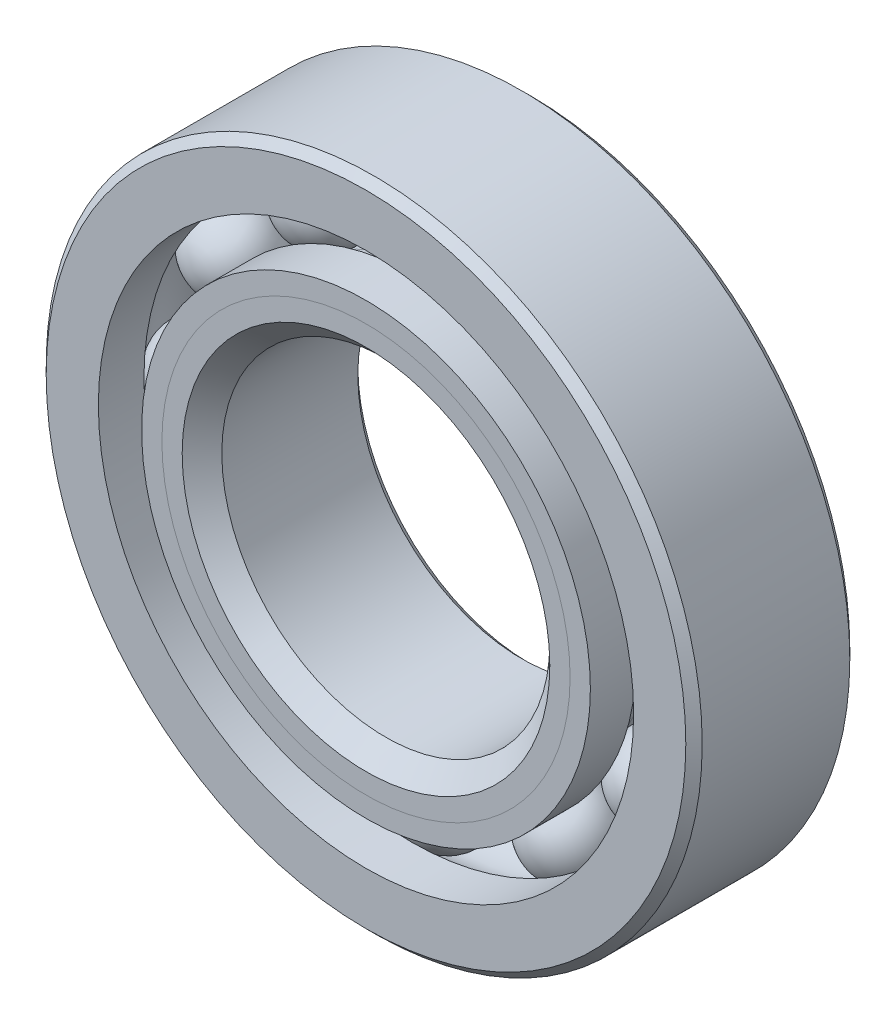
from build123d import *

# Parameters (mm, degrees)
CIRPATTERN1_COUNT = 12


with BuildPart() as part:
    # Sketch1 → Revolve1 (revolve)
    with BuildSketch(Plane(origin=(0, 0, 0), x_dir=(0, 0, -1), z_dir=(1, 0, 0))):
        with BuildLine():
            Line((7.14375, 31.75), (-7.14375, 31.75))
            Line((-7.14375, 31.75), (-7.9375, 30.95625))
            Line((-7.9375, 30.95625), (-7.9375, 25.905906593))
            Line((-7.9375, 25.905906593), (-3.527777778, 25.905906593))
            ThreePointArc((-3.527777778, 25.905906593), (0, 27.914641784), (3.527777778, 25.905906593))
            Line((3.527777778, 25.905906593), (7.9375, 25.905906593))
            Line((7.9375, 25.905906593), (7.9375, 30.95625))
            Line((7.9375, 30.95625), (7.14375, 31.75))
        make_face()
    revolve(axis=Axis((0, 0, 7.9375), (0, 0, -1)))


with BuildPart() as body_2:
    # Sketch2 → Revolve2 (revolve)
    with BuildSketch(Plane(origin=(0, 0, 0), x_dir=(0, 0, -1), z_dir=(1, 0, 0))):
        with BuildLine():
            Line((-7.9375, 21.719093407), (-3.527777778, 21.719093407))
            ThreePointArc((-3.527777778, 21.719093407), (-2.029792669, 20.24774069), (0, 19.710358216))
            Line((0, 19.710358216), (0, 17.792679108))
            Line((0, 17.792679108), (-5.974292851, 17.792679108))
            Line((-5.974292851, 17.792679108), (-7.9375, 19.755886257))
            Line((-7.9375, 19.755886257), (-7.9375, 21.719093407))
        make_face()
    revolve(axis=Axis((0, 0, 7.9375), (0, 0, -1)))


with BuildPart() as body_3:
    # Sketch3 → Revolve3 (revolve)
    with BuildSketch(Plane(origin=(0, 0, 0), x_dir=(0, 0, -1), z_dir=(1, 0, 0))):
        with BuildLine():
            Line((-7.9375, 19.755886257), (-5.974292851, 17.792679108))
            Line((-5.974292851, 17.792679108), (0, 17.792679108))
            Line((0, 17.792679108), (0, 19.710358216))
            ThreePointArc((0, 19.710358216), (2.029792669, 20.24774069), (3.527777778, 21.719093407))
            Line((3.527777778, 21.719093407), (7.9375, 21.719093407))
            Line((7.9375, 21.719093407), (7.9375, 16.66875))
            Line((7.9375, 16.66875), (7.14375, 15.875))
            Line((7.14375, 15.875), (-6.019820892, 15.875))
            Line((-6.019820892, 15.875), (-7.9375, 17.792679108))
            Line((-7.9375, 17.792679108), (-7.9375, 19.755886257))
        make_face()
    revolve(axis=Axis((0, 0, 7.9375), (0, 0, -1)))


with BuildPart() as body_4:
    # Sketch4 → Revolve4 (revolve)
    with BuildSketch(Plane(origin=(0, 0, 0), x_dir=(0, 0, -1), z_dir=(1, 0, 0))):
        with BuildLine():
            Line((-4.102141784, 23.8125), (4.102141784, 23.8125))
            ThreePointArc((4.102141784, 23.8125), (0, 27.914641784), (-4.102141784, 23.8125))
        make_face()
    revolve(axis=Axis((0, 23.8125, 4.102141784), (0, 0, -1)))


with BuildPart() as cirpattern1_1:
    # CirPattern1: pattern copy
    add(body_4.part.rotate(Axis((0, 0, -7.9375), (0, 0, 1)), 1 * 360 / CIRPATTERN1_COUNT))


with BuildPart() as cirpattern1_2:
    # CirPattern1: pattern copy
    add(body_4.part.rotate(Axis((0, 0, -7.9375), (0, 0, 1)), 2 * 360 / CIRPATTERN1_COUNT))


with BuildPart() as cirpattern1_3:
    # CirPattern1: pattern copy
    add(body_4.part.rotate(Axis((0, 0, -7.9375), (0, 0, 1)), 3 * 360 / CIRPATTERN1_COUNT))


with BuildPart() as cirpattern1_4:
    # CirPattern1: pattern copy
    add(body_4.part.rotate(Axis((0, 0, -7.9375), (0, 0, 1)), 4 * 360 / CIRPATTERN1_COUNT))


with BuildPart() as cirpattern1_5:
    # CirPattern1: pattern copy
    add(body_4.part.rotate(Axis((0, 0, -7.9375), (0, 0, 1)), 5 * 360 / CIRPATTERN1_COUNT))


with BuildPart() as cirpattern1_6:
    # CirPattern1: pattern copy
    add(body_4.part.rotate(Axis((0, 0, -7.9375), (0, 0, 1)), 6 * 360 / CIRPATTERN1_COUNT))


with BuildPart() as cirpattern1_7:
    # CirPattern1: pattern copy
    add(body_4.part.rotate(Axis((0, 0, -7.9375), (0, 0, 1)), 7 * 360 / CIRPATTERN1_COUNT))


with BuildPart() as cirpattern1_8:
    # CirPattern1: pattern copy
    add(body_4.part.rotate(Axis((0, 0, -7.9375), (0, 0, 1)), 8 * 360 / CIRPATTERN1_COUNT))


with BuildPart() as cirpattern1_9:
    # CirPattern1: pattern copy
    add(body_4.part.rotate(Axis((0, 0, -7.9375), (0, 0, 1)), 9 * 360 / CIRPATTERN1_COUNT))


with BuildPart() as cirpattern1_10:
    # CirPattern1: pattern copy
    add(body_4.part.rotate(Axis((0, 0, -7.9375), (0, 0, 1)), 10 * 360 / CIRPATTERN1_COUNT))


with BuildPart() as cirpattern1_11:
    # CirPattern1: pattern copy
    add(body_4.part.rotate(Axis((0, 0, -7.9375), (0, 0, 1)), 11 * 360 / CIRPATTERN1_COUNT))


solid = Compound([part.part, body_2.part, body_3.part, body_4.part, cirpattern1_1.part, cirpattern1_2.part, cirpattern1_3.part, cirpattern1_4.part, cirpattern1_5.part, cirpattern1_6.part, cirpattern1_7.part, cirpattern1_8.part, cirpattern1_9.part, cirpattern1_10.part, cirpattern1_11.part])
